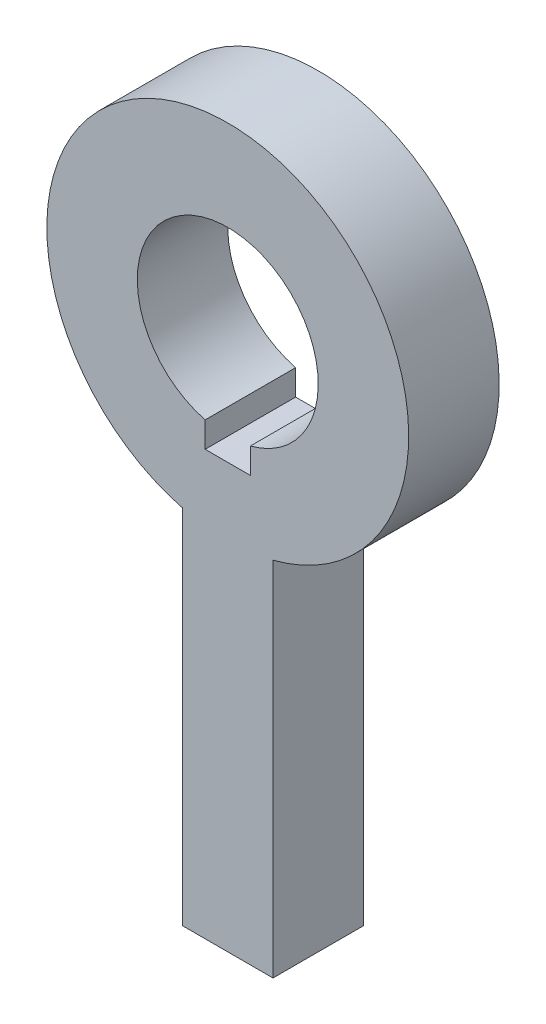
from build123d import *

# Parameters (mm, degrees)
BOSS_EXTRUDE1_DEPTH = 10


with BuildPart() as part:
    # Sketch1 → Boss-Extrude1 (new body)
    with BuildSketch(Plane.XY):
        with BuildLine():
            Line((-5, -59.364916731), (5, -59.364916731))
            Line((5, -59.364916731), (5, -19.364916731))
            ThreePointArc((5, -19.364916731), (0, 20), (-5, -19.364916731))
            Line((-5, -19.364916731), (-5, -59.364916731))
        make_face()
        with BuildLine():
            Line((-2.5, -12.5), (2.5, -12.5))
            Line((2.5, -12.5), (2.5, -9.682458366))
            ThreePointArc((2.5, -9.682458366), (0, 10), (-2.5, -9.682458366))
            Line((-2.5, -9.682458366), (-2.5, -12.5))
        make_face(mode=Mode.SUBTRACT)
    extrude(amount=BOSS_EXTRUDE1_DEPTH)


solid = part.part
